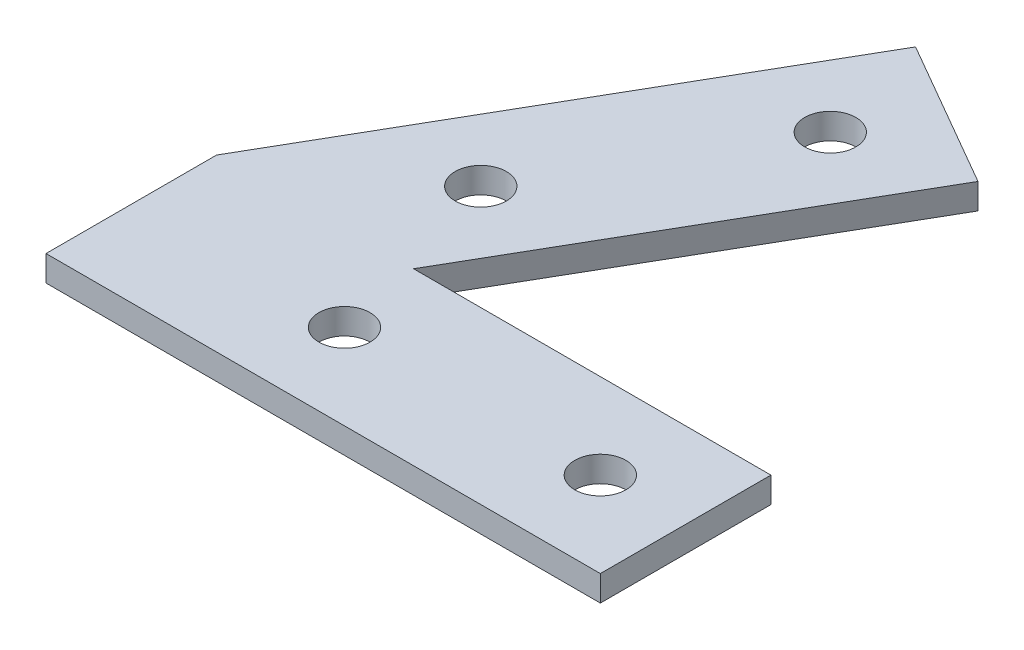
from build123d import *

# Parameters (mm, degrees)
SKETCH_1_R      = 3
EXTRUDE_1_DEPTH = 3


with BuildPart() as part:
    # 草图1 → 凸台-拉伸1 (new body)
    with BuildSketch(Plane(origin=(0, 0, 0), x_dir=(1, 0, 0), z_dir=(0, 1, 0))):
        Polygon((0, 0), (0, 20), (30, 71.961524227), (47.320508076, 61.961524227), (23.094010768, 20), (65, 20), (65, 0), align=None)
        with Locations(Location((18.660254038, 32.320508076, 0), (0, 0, 270))):
            Circle(SKETCH_1_R, mode=Mode.SUBTRACT)
        with Locations(Location((33.660254038, 58.301270189, 0), (0, 0, 270))):
            Circle(SKETCH_1_R, mode=Mode.SUBTRACT)
        with Locations(Location((25, 10, 0), (0, 0, 270))):
            Circle(SKETCH_1_R, mode=Mode.SUBTRACT)
        with Locations(Location((55, 10, 0), (0, 0, 270))):
            Circle(SKETCH_1_R, mode=Mode.SUBTRACT)
    extrude(amount=EXTRUDE_1_DEPTH)


solid = part.part
